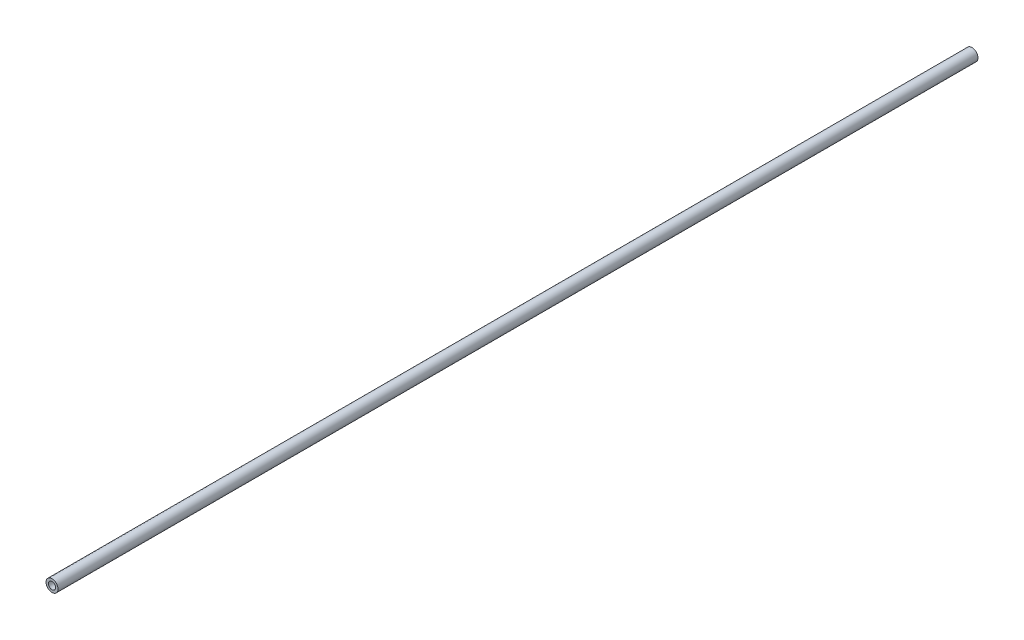
from build123d import *

# Parameters (mm, degrees)
SKETCH2_W = 304.8
SKETCH2_H = 0.79375


with BuildPart() as part:
    # Sketch2 → Revolve1 (revolve)
    with BuildSketch(Plane(origin=(0, 0, 0), x_dir=(0, 0, -1), z_dir=(1, 0, 0)), mode=Mode.PRIVATE) as revolve1_sk:
        with Locations((0, 1.5875)):
            Rectangle(SKETCH2_W, SKETCH2_H)
    revolve(revolve1_sk.sketch.rotate(Axis((0, 0, 152.4), (0, 0, -1)), 180), axis=Axis((0, 0, 152.4), (0, 0, -1)))


solid = part.part
